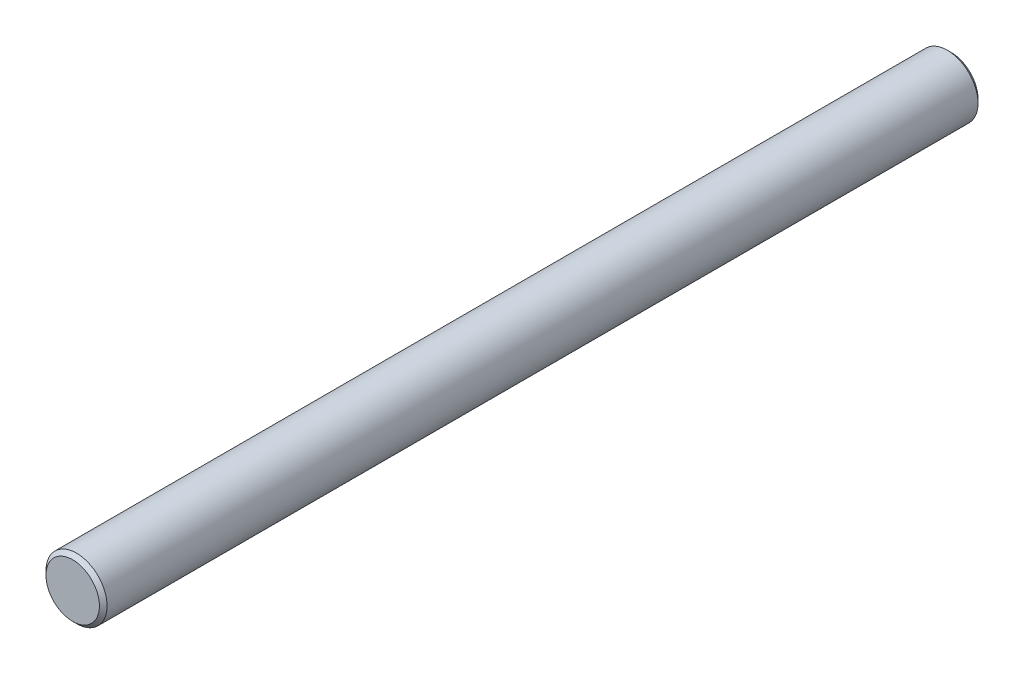
from build123d import *

# Parameters (mm, degrees)
SKETCH1_R           = 4
BOSS_EXTRUDE1_DEPTH = 57.5
CHAMFER1_SIZE       = 0.5


with BuildPart() as part:
    # Sketch1 → Boss-Extrude1 (new, symmetric)
    with BuildSketch(Plane.XY):
        Circle(SKETCH1_R)
    extrude(amount=BOSS_EXTRUDE1_DEPTH, both=True)

    # Chamfer1
    chamfer1_edges = [part.edges().sort_by_distance(p)[0] for p in [
        (-4, 0, -57.5),
        (-4, 0, 57.5),
    ]]
    chamfer(chamfer1_edges, length=CHAMFER1_SIZE)


solid = part.part
